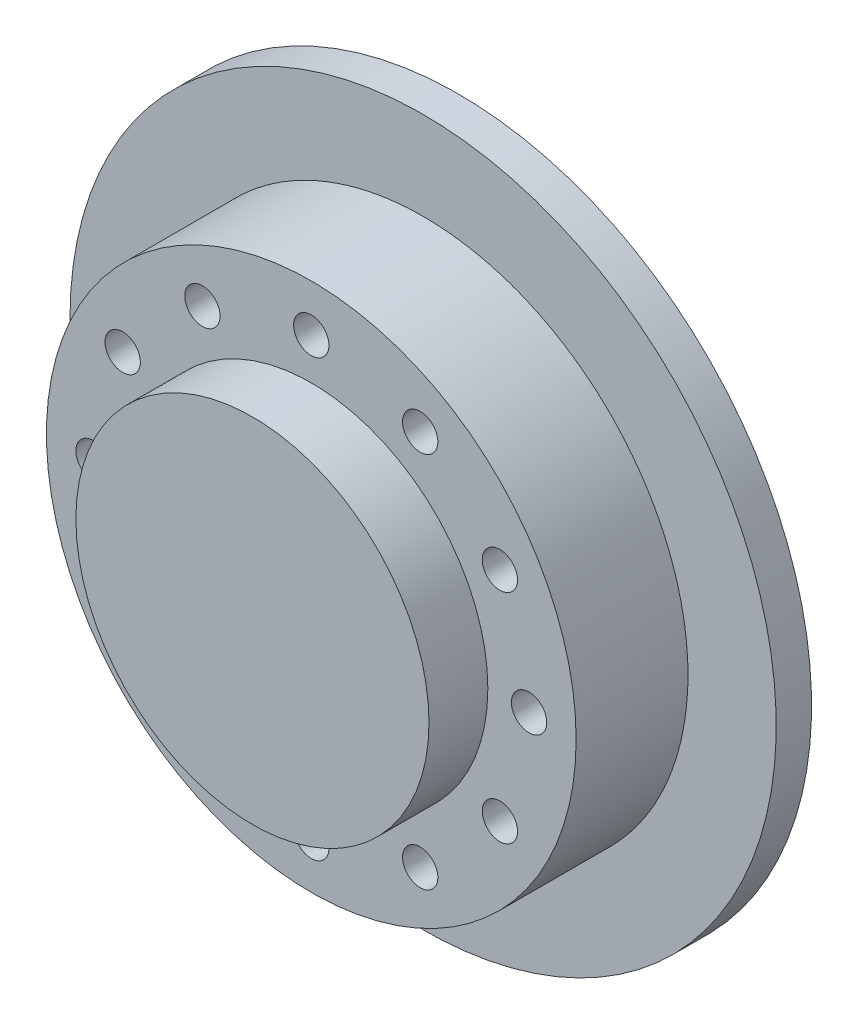
from build123d import *

# Parameters (mm, degrees)
SKETCH_1_R               = 22.5
EXTRUDE_1_DEPTH          = 12.5
SKETCH_2_R               = 15
EXTRUDE_2_DEPTH          = 5
SKETCH_3_R               = 1.5
CUT_EXTRUDE_1_DEPTH      = 5
SKETCH_5_R               = 1.5
CUT_EXTRUDE_2_DEPTH      = 35.186985828
CUT_EXTRUDE_6_DEPTH      = 3
PATTERN_CIRCULAR_1_COUNT = 12
SKETCH_10_R              = 30
SKETCH_10_R_2            = 22.5
EXTRUDE_3_DEPTH          = 3


with BuildPart() as part:
    # 草图1 → 凸台-拉伸1 (new body)
    with BuildSketch(Plane.XY):
        Circle(SKETCH_1_R)
    extrude(amount=EXTRUDE_1_DEPTH)

    # 草图2 → 凸台-拉伸2 (add)
    with BuildSketch(Plane.XY.offset(12.5)):
        Circle(SKETCH_2_R)
    extrude(amount=EXTRUDE_2_DEPTH)

    # 草图3 → 切除-拉伸1 (cut)
    with BuildSketch(Plane.XY.offset(12.5)):
        with Locations((0, 18.5)):
            Circle(SKETCH_3_R)
    cut_extrude_1 = extrude(amount=-CUT_EXTRUDE_1_DEPTH, mode=Mode.SUBTRACT)

    # 草图5 → 切除-拉伸2 (cut, through all)
    with BuildSketch(Plane.XY.offset(12.5)):
        with Locations((0, 18.5)):
            Circle(SKETCH_5_R)
    cut_extrude_2 = extrude(amount=-CUT_EXTRUDE_2_DEPTH, mode=Mode.SUBTRACT)

    # 草图9 → 切除-拉伸6 (cut)
    with BuildSketch(Plane(origin=(0, 0, 0), x_dir=(-1, 0, 0), z_dir=(0, 0, -1))):
        Polygon((1.204492644, 21.438116881), (-1.942237536, 21.012179669), (-3.14673018, 18.074062788), (-1.204492644, 15.561883119), (1.942237536, 15.987820331), (3.14673018, 18.925937212), align=None)
    cut_extrude_6 = extrude(amount=-CUT_EXTRUDE_6_DEPTH, mode=Mode.SUBTRACT)

    # 阵列(圆周)1: 切除-拉伸1, 切除-拉伸2, 切除-拉伸6 ×12 about axis
    pattern_circular_1_axis = Axis((0, 0, 0), (0, 0, 1))
    add([cut_extrude_1.rotate(pattern_circular_1_axis, i * 360 / PATTERN_CIRCULAR_1_COUNT) for i in range(1, PATTERN_CIRCULAR_1_COUNT)], mode=Mode.SUBTRACT)
    add([cut_extrude_2.rotate(pattern_circular_1_axis, i * 360 / PATTERN_CIRCULAR_1_COUNT) for i in range(1, PATTERN_CIRCULAR_1_COUNT)], mode=Mode.SUBTRACT)
    add([cut_extrude_6.rotate(pattern_circular_1_axis, i * 360 / PATTERN_CIRCULAR_1_COUNT) for i in range(1, PATTERN_CIRCULAR_1_COUNT)], mode=Mode.SUBTRACT)


with BuildPart() as body_2:
    # 草图10 → 凸台-拉伸3 (new body)
    with BuildSketch(Plane(origin=(0, 0, 0), x_dir=(-1, 0, 0), z_dir=(0, 0, -1))):
        Circle(SKETCH_10_R)
        Circle(SKETCH_10_R_2, mode=Mode.SUBTRACT)
    extrude(amount=-EXTRUDE_3_DEPTH)


solid = Compound([part.part, body_2.part])
